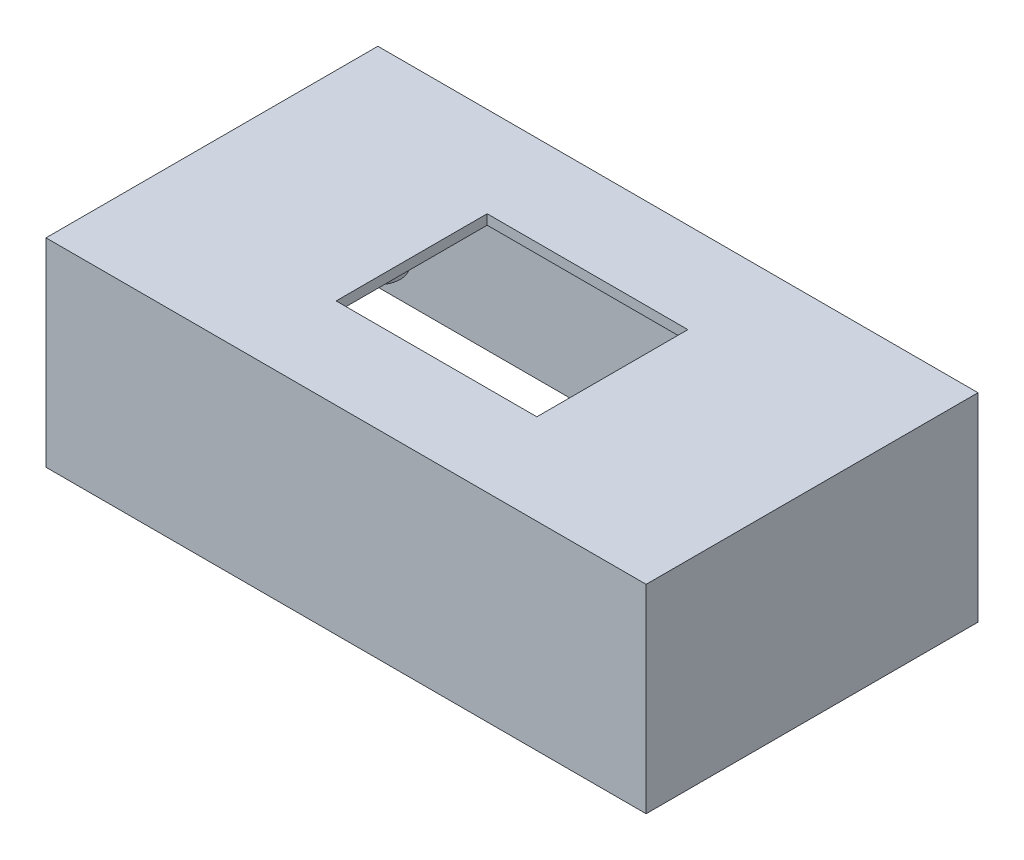
from build123d import *

# Parameters (mm, degrees)
SKETCH1_W           = 60.4
SKETCH1_H           = 33.4
SKETCH1_W_2         = 58.4
SKETCH1_H_2         = 31.4
BOSS_EXTRUDE1_DEPTH = 19
SKETCH2_W           = 60.4
SKETCH2_H           = 33.4
SKETCH2_W_2         = 20.2
SKETCH2_H_2         = 15.2
BOSS_EXTRUDE2_DEPTH = 1
SKETCH3_R           = 1.25
BOSS_EXTRUDE3_DEPTH = 14
CUT_EXTRUDE1_REACH  = 67.78
SKETCH4_W           = 8
SKETCH4_H           = 4


with BuildPart() as part:
    # Sketch1 → Boss-Extrude1 (new body)
    with BuildSketch(Plane(origin=(0, 0, 0), x_dir=(1, 0, 0), z_dir=(0, 1, 0))):
        Rectangle(SKETCH1_W, SKETCH1_H)
        Rectangle(SKETCH1_W_2, SKETCH1_H_2, mode=Mode.SUBTRACT)
    extrude(amount=BOSS_EXTRUDE1_DEPTH)

    # Sketch2 → Boss-Extrude2 (add)
    with BuildSketch(Plane(origin=(0, 19, 0), x_dir=(1, 0, 0), z_dir=(0, 1, 0))):
        Rectangle(SKETCH2_W, SKETCH2_H)
        Rectangle(SKETCH2_W_2, SKETCH2_H_2, mode=Mode.SUBTRACT)
    extrude(amount=BOSS_EXTRUDE2_DEPTH)

    # Sketch3 → Boss-Extrude3 (add)
    # profile 1 of 4: a face of its own
    with BuildSketch(Plane.XZ.offset(-19)):
        with BuildLine():
            Line((-29.2, 15.7), (-26, 15.7))
            Line((-26, 15.7), (-26, 15.592329219))
            ThreePointArc((-26, 15.592329219), (-25.80860754, 15.003980814), (-25.307692308, 14.640843306))
            ThreePointArc((-25.307692308, 14.640843306), (-24.409009742, 10.909009742), (-28.140843306, 11.807692308))
            ThreePointArc((-28.140843306, 11.807692308), (-28.503980814, 12.30860754), (-29.092329219, 12.5))
            Line((-29.092329219, 12.5), (-29.2, 12.5))
            Line((-29.2, 12.5), (-29.2, 15.7))
        make_face()
        with Locations(Location((-26, 12.5, 0), (0, 0, 90))):
            Circle(SKETCH3_R, mode=Mode.SUBTRACT)
    # profile 2 of 4: a face of its own
    with BuildSketch(Plane.XZ.offset(-19)):
        with BuildLine():
            Line((29.2, 12.5), (29.2, 15.7))
            Line((29.2, 15.7), (26, 15.7))
            Line((26, 15.7), (26, 15.592329219))
            ThreePointArc((26, 15.592329219), (25.80860754, 15.003980814), (25.307692308, 14.640843306))
            ThreePointArc((25.307692308, 14.640843306), (24.409009742, 10.909009742), (28.140843306, 11.807692308))
            ThreePointArc((28.140843306, 11.807692308), (28.503980814, 12.30860754), (29.092329219, 12.5))
            Line((29.092329219, 12.5), (29.2, 12.5))
        make_face()
        with Locations(Location((26, 12.5, 0), (0, 0, 90))):
            Circle(SKETCH3_R, mode=Mode.SUBTRACT)
    # profile 3 of 4: a face of its own
    with BuildSketch(Plane.XZ.offset(-19)):
        with BuildLine():
            Line((29.2, -15.7), (26, -15.7))
            Line((26, -15.7), (26, -15.592329219))
            ThreePointArc((26, -15.592329219), (25.80860754, -15.003980814), (25.307692308, -14.640843306))
            ThreePointArc((25.307692308, -14.640843306), (24.409009742, -10.909009742), (28.140843306, -11.807692308))
            ThreePointArc((28.140843306, -11.807692308), (28.503980814, -12.30860754), (29.092329219, -12.5))
            Line((29.092329219, -12.5), (29.2, -12.5))
            Line((29.2, -12.5), (29.2, -15.7))
        make_face()
        with Locations(Location((26, -12.5, 0), (0, 0, 90))):
            Circle(SKETCH3_R, mode=Mode.SUBTRACT)
    # profile 4 of 4: a face of its own
    with BuildSketch(Plane.XZ.offset(-19)):
        with BuildLine():
            Line((-29.2, -12.5), (-29.2, -15.7))
            Line((-29.2, -15.7), (-26, -15.7))
            Line((-26, -15.7), (-26, -15.592329219))
            ThreePointArc((-26, -15.592329219), (-25.80860754, -15.003980814), (-25.307692308, -14.640843306))
            ThreePointArc((-25.307692308, -14.640843306), (-24.409009742, -10.909009742), (-28.140843306, -11.807692308))
            ThreePointArc((-28.140843306, -11.807692308), (-28.503980814, -12.30860754), (-29.092329219, -12.5))
            Line((-29.092329219, -12.5), (-29.2, -12.5))
        make_face()
        with Locations(Location((-26, -12.5, 0), (0, 0, 90))):
            Circle(SKETCH3_R, mode=Mode.SUBTRACT)
    extrude(amount=BOSS_EXTRUDE3_DEPTH)

    # Sketch4 → Cut-Extrude1 (cut, up to next)
    with BuildSketch(Plane.ZY.offset(30.2), mode=Mode.PRIVATE) as cut_extrude1_sk1:
        with Locations((0, 2)):
            Rectangle(SKETCH4_W, SKETCH4_H)
    cut_extrude1_tool1 = extrude(cut_extrude1_sk1.sketch, amount=-CUT_EXTRUDE1_REACH, mode=Mode.PRIVATE) & part.part
    add(cut_extrude1_tool1.solids().sort_by_distance((-30.2, 2, 0))[0], mode=Mode.SUBTRACT)


solid = part.part
